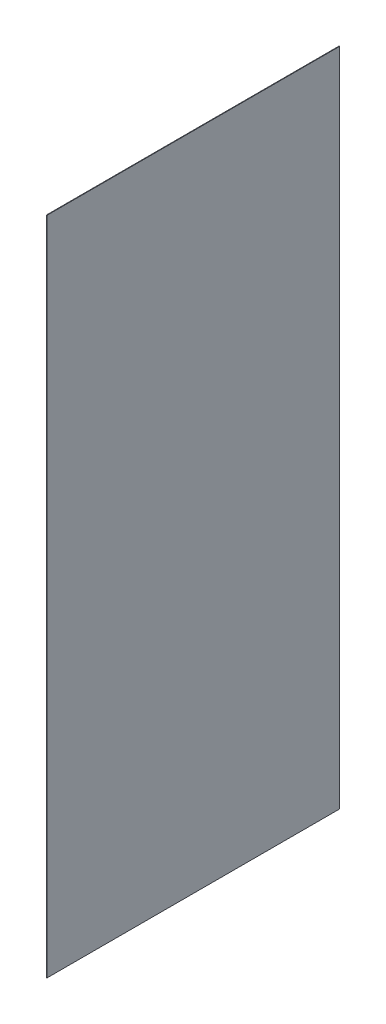
from build123d import *

# Parameters (mm, degrees)
SKETCH1_W                 = 1.5
SKETCH1_H                 = 1850
STORE_DIS_YAN_SAG_1_DEPTH = 820


with BuildPart() as part:
    # Sketch1 → STORE_dis_yan_sag_1 (new body)
    with BuildSketch(Plane.XY):
        with Locations((1399.25, 1045)):
            Rectangle(SKETCH1_W, SKETCH1_H)
    extrude(amount=-STORE_DIS_YAN_SAG_1_DEPTH)


solid = part.part
